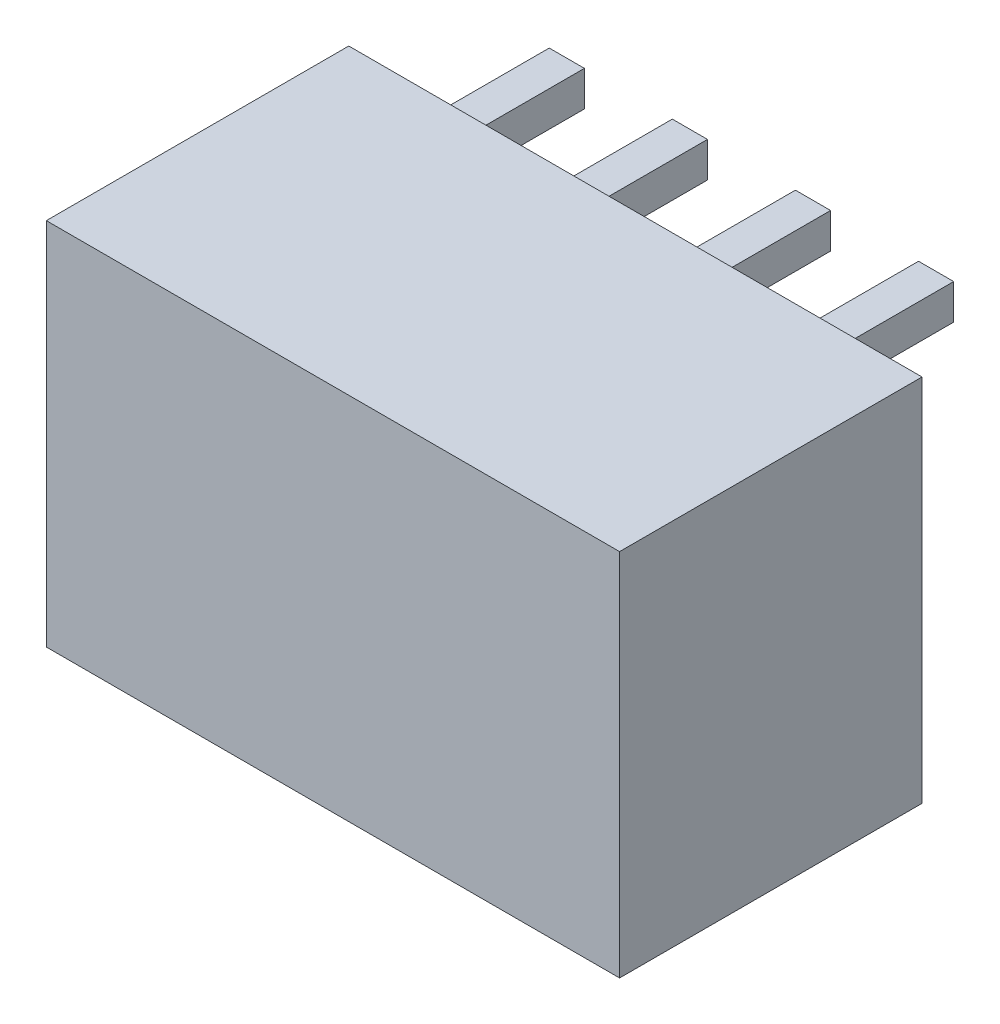
from build123d import *

# Parameters (mm, degrees)
SKETCH_1_W                         = 16.3
SKETCH_1_H                         = 10.5
EXTRUDE_1_DEPTH                    = 8.6
CUT_EXTRUDE_1_DEPTH                = 7
EXTRUDE_START                      = -5
SKETCH_3_W                         = 1
SKETCH_3_H                         = 1
EXTRUDE_2_DEPTH                    = 8.6
CHAMFER_1_SIZE                     = 0.3
PATTERN_LINEAR_1_COUNT             = 4
PATTERN_LINEAR_1_PITCH             = 3.5
CHAMFER_1_OF_PATTERN_LINEAR_1_SIZE = 0.3


with BuildPart() as part:
    # Эскиз1 → Бобышка-Вытянуть1 (new body)
    with BuildSketch(Plane.XY):
        Rectangle(SKETCH_1_W, SKETCH_1_H)
    extrude(amount=EXTRUDE_1_DEPTH)

    # Эскиз2 → Вырез-Вытянуть1 (cut)
    with BuildSketch(Plane.XZ.offset(5.25)):
        Polygon((-7.15, 6.6), (7.15, 6.6), (7.15, 0.2), (4.95, 0.2), (4.95, 1.8), (-3.35, 1.8), (-3.35, 0.2), (-5.55, 0.2), (-5.55, 1.8), (-7.15, 1.8), align=None)
    extrude(amount=-CUT_EXTRUDE_1_DEPTH, mode=Mode.SUBTRACT)

    # Эскиз3 → Бобышка-Вытянуть2 (add)
    with BuildSketch(Plane(origin=(0, 0, 0), x_dir=(-1, 0, 0), z_dir=(0, 0, -1)).offset(EXTRUDE_START)):
        with Locations((5.25, 4.25)):
            Rectangle(SKETCH_3_W, SKETCH_3_H)
    extrude_2 = extrude(amount=EXTRUDE_2_DEPTH)

    # Фаска1
    chamfer_1_edges = [part.edges().sort_by_distance(p)[0] for p in [
        (-4.75, 4.25, -3.6),
        (-5.25, 3.75, -3.6),
        (-5.75, 4.25, -3.6),
        (-5.25, 4.75, -3.6),
    ]]
    chamfer(chamfer_1_edges, length=CHAMFER_1_SIZE)

    # Линейный массив1: Бобышка-Вытянуть2 ×4
    with Locations(*[(i * PATTERN_LINEAR_1_PITCH, 0, 0) for i in range(1, PATTERN_LINEAR_1_COUNT)]):
        add(extrude_2)

    # Фаска1 of Линейный массив1
    chamfer_1_of_pattern_linear_1_edges = [part.edges().sort_by_distance(p)[0] for p in [
        (-1.25, 4.25, -3.6),
        (-1.75, 3.75, -3.6),
        (-2.25, 4.25, -3.6),
        (-1.75, 4.75, -3.6),
        (2.25, 4.25, -3.6),
        (1.75, 3.75, -3.6),
        (1.25, 4.25, -3.6),
        (1.75, 4.75, -3.6),
        (5.75, 4.25, -3.6),
        (5.25, 3.75, -3.6),
        (4.75, 4.25, -3.6),
        (5.25, 4.75, -3.6),
    ]]
    chamfer(chamfer_1_of_pattern_linear_1_edges, length=CHAMFER_1_OF_PATTERN_LINEAR_1_SIZE)


solid = part.part
